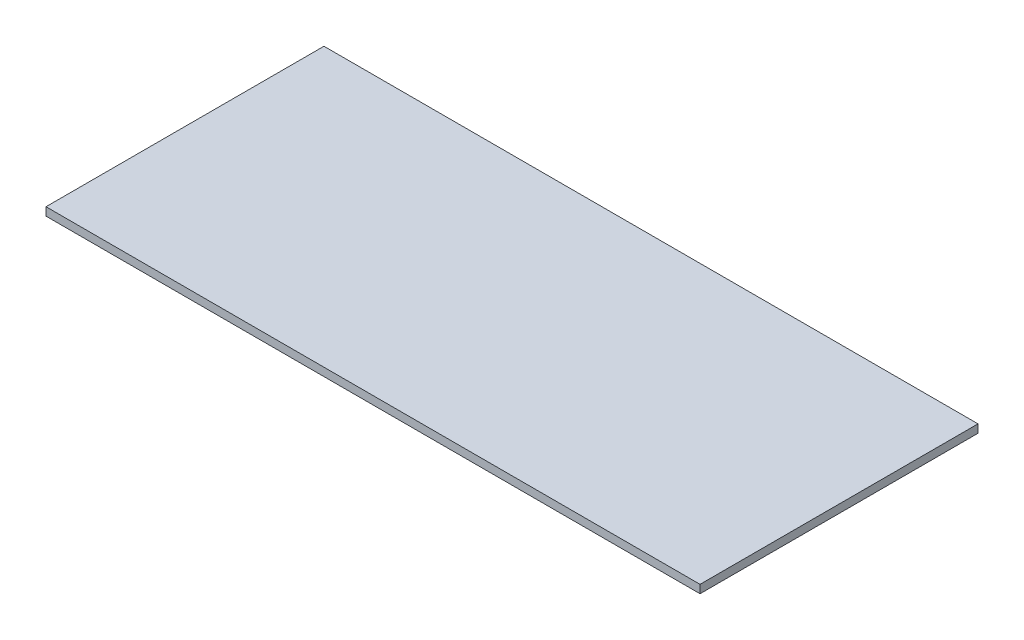
from build123d import *

# Parameters (mm, degrees)
SKETCH2_W           = 508
SKETCH2_H           = 215.9
BOSS_EXTRUDE2_DEPTH = 6.35


with BuildPart() as part:
    # Sketch2 → Boss-Extrude2 (new body)
    with BuildSketch(Plane(origin=(0, 0, 0), x_dir=(1, 0, 0), z_dir=(0, 1, 0))):
        Rectangle(SKETCH2_W, SKETCH2_H)
    extrude(amount=BOSS_EXTRUDE2_DEPTH)


solid = part.part
